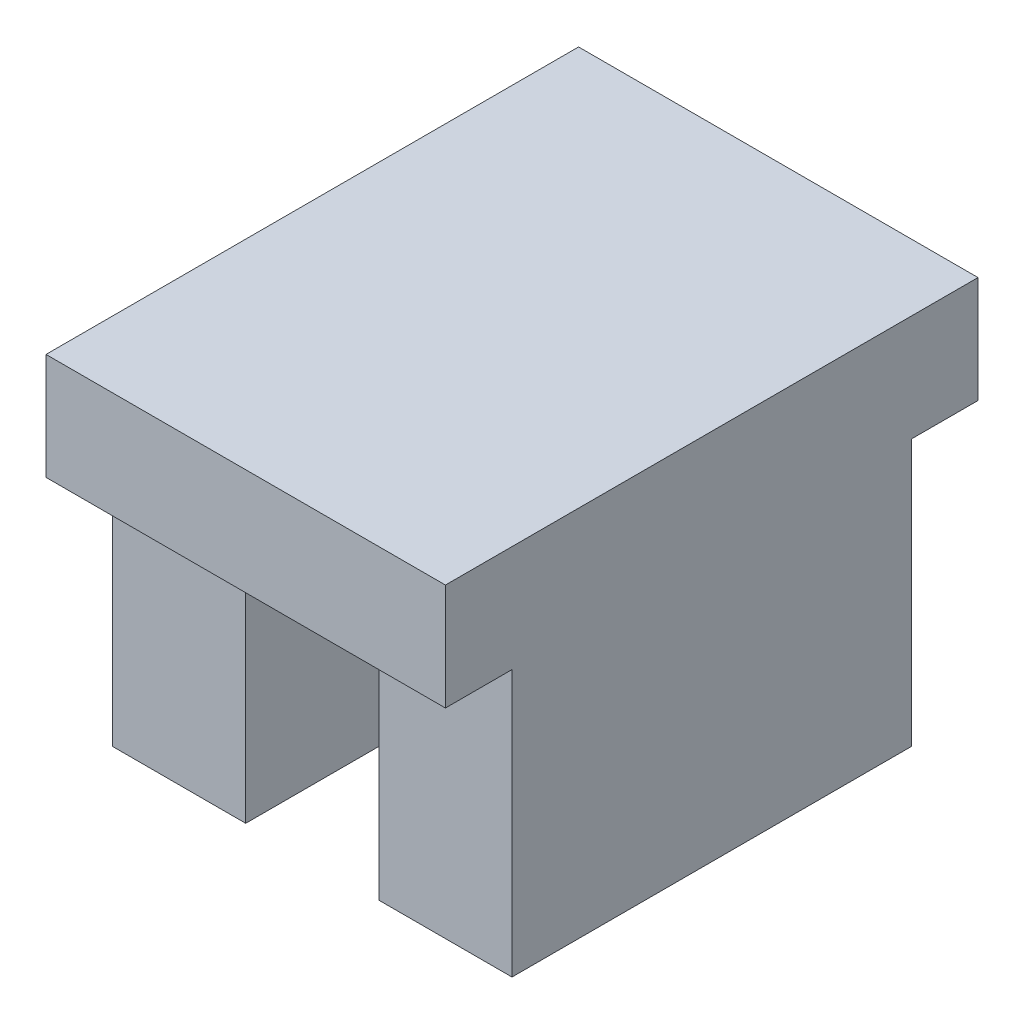
from build123d import *

# Parameters (mm, degrees)
ESQUISSE1_W                 = 30
ESQUISSE1_H                 = 40
CORPS_BOUTON_POUSSOIR_DEPTH = 8
ESQUISSE2_W                 = 10
ESQUISSE2_H                 = 30
F_2_CONTACTS_DEPTH          = 20


with BuildPart() as part:
    # Esquisse1 → corps bouton poussoir (new body)
    with BuildSketch(Plane(origin=(0, 0, 0), x_dir=(1, 0, 0), z_dir=(0, 1, 0))):
        with Locations((15, 20)):
            Rectangle(ESQUISSE1_W, ESQUISSE1_H)
    extrude(amount=CORPS_BOUTON_POUSSOIR_DEPTH)

    # Esquisse2 → 2 contacts (add)
    with BuildSketch(Plane.XZ):
        with Locations((5, -20)):
            Rectangle(ESQUISSE2_W, ESQUISSE2_H)
        with Locations((25, -20)):
            Rectangle(ESQUISSE2_W, ESQUISSE2_H)
    extrude(amount=F_2_CONTACTS_DEPTH)


solid = part.part
